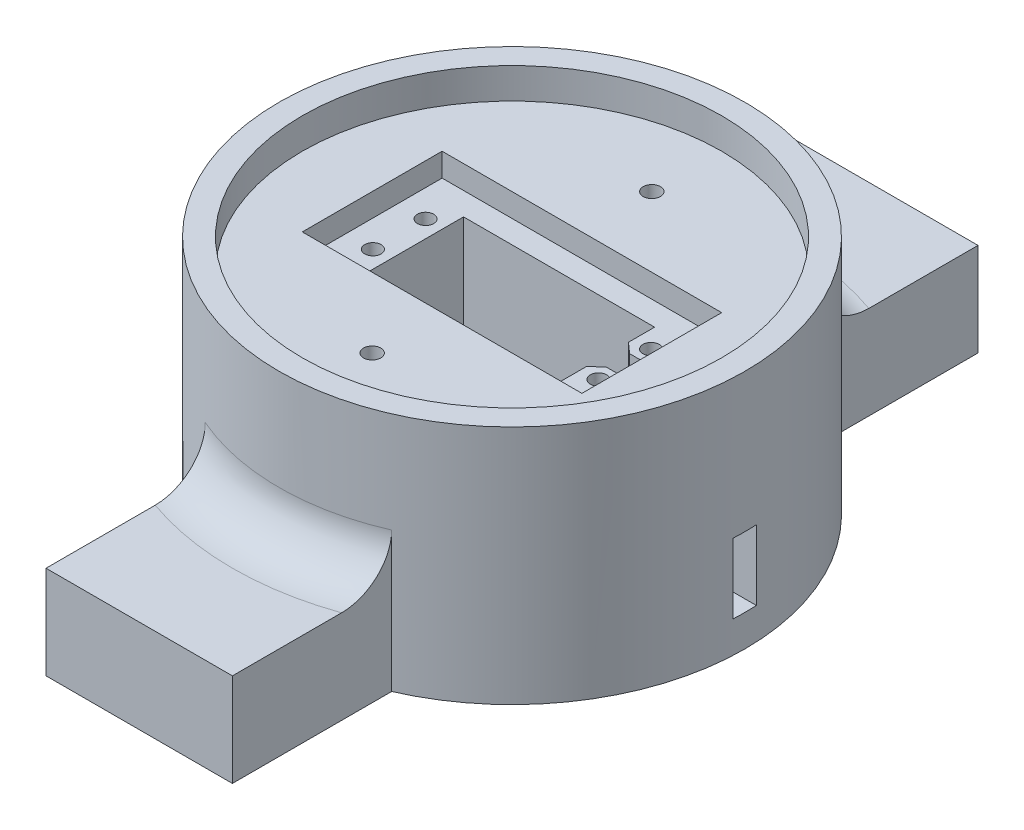
from build123d import *

# Parameters (mm, degrees)
ESQUISSE1_R             = 50
BOSS_EXTRU_1_DEPTH      = 45
ESQUISSE2_W             = 60
ESQUISSE2_H             = 30
ENL_V_MAT_EXTRU_2_DEPTH = 5
ENL_V_MAT_EXTRU_4_DEPTH = 38.2
ESQUISSE2_4_R           = 50
ESQUISSE2_4_R_2         = 45
BOSS_EXTRU_2_DEPTH      = 6.6
ESQUISSE2_5_R           = 1.75
ENL_V_MAT_EXTRU_5_DEPTH = 10
ESQUISSE3_R             = 1.85
ENL_V_MAT_EXTRU_6_DEPTH = 10
BOSS_EXTRU_3_START      = -13
ESQUISSE4_W             = 40
ESQUISSE4_H             = 20
BOSS_EXTRU_3_DEPTH      = 43
CONG_1_R                = 10
ESQUISSE5_W             = 5
ESQUISSE5_H             = 15
ENL_V_MAT_EXTRU_7_DEPTH = 124.388856936


with BuildPart() as part:
    # Esquisse1 → Boss.-Extru.1 (new body)
    with BuildSketch(Plane(origin=(0, 0, 0), x_dir=(1, 0, 0), z_dir=(0, 1, 0))):
        Circle(ESQUISSE1_R)
    extrude(amount=BOSS_EXTRU_1_DEPTH)

    # Esquisse2 → Enlèv. mat.-Extru.2 (cut)
    with BuildSketch(Plane(origin=(0, 45, 0), x_dir=(1, 0, 0), z_dir=(0, 1, 0))):
        Rectangle(ESQUISSE2_W, ESQUISSE2_H)
    extrude(amount=-ENL_V_MAT_EXTRU_2_DEPTH, mode=Mode.SUBTRACT)

    # Esquisse2<3> → Enlèv. mat.-Extru.4 (cut)
    with BuildSketch(Plane(origin=(0, 45, 0), x_dir=(1, 0, 0), z_dir=(0, 1, 0))):
        Polygon((-20.5, 10.1), (20.5, 10.1), (20.5, 4.5), (22.736067977, 2.5), (28.5, 2.5), (28.5, -2.5), (22.736067977, -2.5), (20.5, -4.5), (20.5, -10.1), (-20.5, -10.1), align=None)
    extrude(amount=-ENL_V_MAT_EXTRU_4_DEPTH, mode=Mode.SUBTRACT)

    # Esquisse2<4> → Boss.-Extru.2 (add)
    with BuildSketch(Plane(origin=(0, 45, 0), x_dir=(1, 0, 0), z_dir=(0, 1, 0))):
        Circle(ESQUISSE2_4_R)
        Circle(ESQUISSE2_4_R_2, mode=Mode.SUBTRACT)
    extrude(amount=BOSS_EXTRU_2_DEPTH)

    # Esquisse2<5> → Enlèv. mat.-Extru.5 (cut)
    with BuildSketch(Plane(origin=(0, 45, 0), x_dir=(1, 0, 0), z_dir=(0, 1, 0))):
        with Locations((-24.2, 5.65)):
            Circle(ESQUISSE2_5_R)
        with Locations((-24.2, -5.65)):
            Circle(ESQUISSE2_5_R)
        with Locations((24.2, -5.65)):
            Circle(ESQUISSE2_5_R)
        with Locations((24.2, 5.65)):
            Circle(ESQUISSE2_5_R)
    extrude(amount=-ENL_V_MAT_EXTRU_5_DEPTH, mode=Mode.SUBTRACT)

    # Esquisse3 → Enlèv. mat.-Extru.6 (cut)
    with BuildSketch(Plane(origin=(0, 45, 0), x_dir=(1, 0, 0), z_dir=(0, 1, 0))):
        with Locations((0, 30)):
            Circle(ESQUISSE3_R)
        with Locations((0, -30)):
            Circle(ESQUISSE3_R)
    extrude(amount=-ENL_V_MAT_EXTRU_6_DEPTH, mode=Mode.SUBTRACT)

    # Esquisse4 → Boss.-Extru.3 (add)
    with BuildSketch(Plane.XY.offset(50).offset(BOSS_EXTRU_3_START)):
        with Locations((0, 10)):
            Rectangle(ESQUISSE4_W, ESQUISSE4_H)
    boss_extru_3 = extrude(amount=BOSS_EXTRU_3_DEPTH)

    # Symétrie1: Boss.-Extru.3 across plane
    add(boss_extru_3.mirror(Plane.XY))

    # Congé1
    cong_1_edges = [part.edges().sort_by_distance(p)[0] for p in [
        (0, 20, 50),
        (0, 20, -50),
    ]]
    fillet(cong_1_edges, radius=CONG_1_R)

    # Esquisse5 → Enlèv. mat.-Extru.7 (cut, through all)
    with BuildSketch(Plane.ZY.offset(-28.5)):
        with Locations((0, 14.3)):
            Rectangle(ESQUISSE5_W, ESQUISSE5_H)
    extrude(amount=-ENL_V_MAT_EXTRU_7_DEPTH, mode=Mode.SUBTRACT)


solid = part.part
